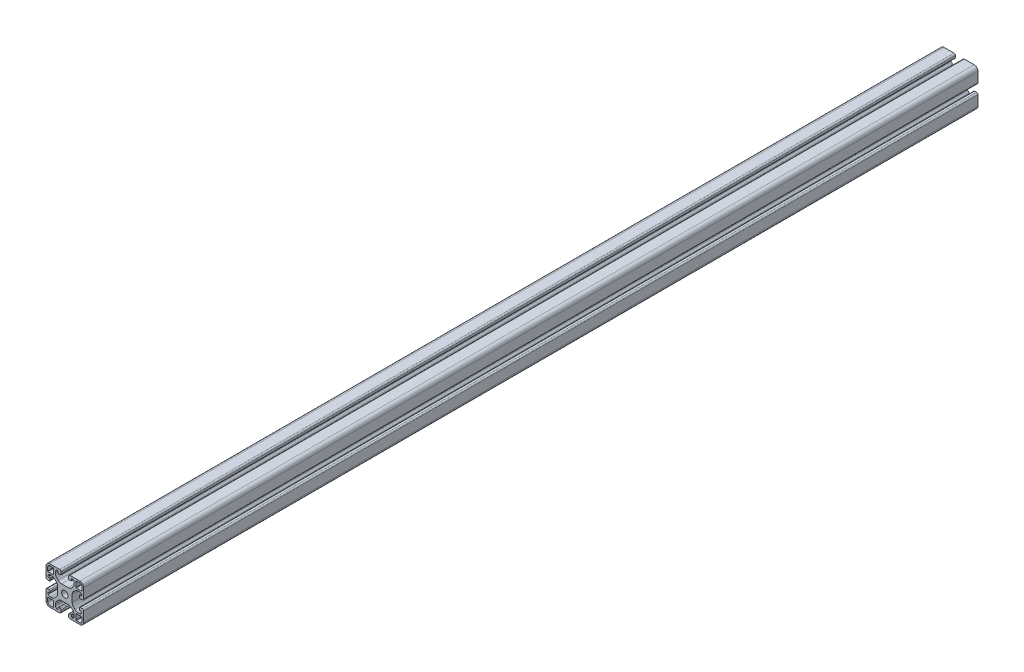
from build123d import *

# Parameters (mm, degrees)
ESQUISSE1_R        = 3.4
BOSS_EXTRU_1_DEPTH = 950


with BuildPart() as part:
    # Esquisse1 → Boss.-Extru.1 (new body)
    with BuildSketch(Plane(origin=(0, 0, -30), x_dir=(-1, 0, 0), z_dir=(0, 0, -1))):
        with BuildLine():
            Line((-4.5, 15), (-4.5, 13.5))
            ThreePointArc((-4.5, 13.5), (-4.353553391, 13.146446609), (-4, 13))
            Line((-4, 13), (-2.5, 13))
            ThreePointArc((-2.5, 13), (-2.146446609, 12.853553391), (-2, 12.5))
            ThreePointArc((-2, 12.5), (-2.732233047, 10.732233047), (-4.5, 10))
            Line((-4.5, 10), (-5.807611845, 10))
            ThreePointArc((-5.807611845, 10), (-7.721029006, 10.380602337), (-9.343145751, 11.464466094))
            Line((-9.343145751, 11.464466094), (-10.785533906, 12.906854249))
            ThreePointArc((-10.785533906, 12.906854249), (-11.869397663, 14.528970994), (-12.25, 16.442388155))
            Line((-12.25, 16.442388155), (-12.25, 23.557611845))
            ThreePointArc((-12.25, 23.557611845), (-11.869397663, 25.471029006), (-10.785533906, 27.093145751))
            Line((-10.785533906, 27.093145751), (-9.343145751, 28.535533906))
            ThreePointArc((-9.343145751, 28.535533906), (-7.721029006, 29.619397663), (-5.807611845, 30))
            Line((-5.807611845, 30), (-4.5, 30))
            ThreePointArc((-4.5, 30), (-2.732233047, 29.267766953), (-2, 27.5))
            ThreePointArc((-2, 27.5), (-2.146446609, 27.146446609), (-2.5, 27))
            Line((-2.5, 27), (-4, 27))
            ThreePointArc((-4, 27), (-4.353553391, 26.853553391), (-4.5, 26.5))
            Line((-4.5, 26.5), (-4.5, 25))
            ThreePointArc((-4.5, 25), (-4.207106781, 24.292893219), (-3.5, 24))
            Line((-3.5, 24), (-1.5, 24))
            ThreePointArc((-1.5, 24), (-0.439339828, 24.439339828), (0, 25.5))
            Line((0, 25.5), (0, 36))
            ThreePointArc((0, 36), (-1.171572875, 38.828427125), (-4, 40))
            Line((-4, 40), (-14.5, 40))
            ThreePointArc((-14.5, 40), (-15.560660172, 39.560660172), (-16, 38.5))
            Line((-16, 38.5), (-16, 36.5))
            ThreePointArc((-16, 36.5), (-15.707106781, 35.792893219), (-15, 35.5))
            Line((-15, 35.5), (-13.5, 35.5))
            ThreePointArc((-13.5, 35.5), (-13.146446609, 35.646446609), (-13, 36))
            Line((-13, 36), (-13, 37.5))
            ThreePointArc((-13, 37.5), (-12.853553391, 37.853553391), (-12.5, 38))
            ThreePointArc((-12.5, 38), (-10.732233047, 37.267766953), (-10, 35.5))
            Line((-10, 35.5), (-10, 34.192388155))
            ThreePointArc((-10, 34.192388155), (-10.380602337, 32.278970994), (-11.464466094, 30.656854249))
            Line((-11.464466094, 30.656854249), (-12.906854249, 29.214466094))
            ThreePointArc((-12.906854249, 29.214466094), (-14.528970994, 28.130602337), (-16.442388155, 27.75))
            Line((-16.442388155, 27.75), (-23.557611845, 27.75))
            ThreePointArc((-23.557611845, 27.75), (-25.471029006, 28.130602337), (-27.093145751, 29.214466094))
            Line((-27.093145751, 29.214466094), (-28.535533906, 30.656854249))
            ThreePointArc((-28.535533906, 30.656854249), (-29.619397663, 32.278970994), (-30, 34.192388155))
            Line((-30, 34.192388155), (-30, 35.5))
            ThreePointArc((-30, 35.5), (-29.267766953, 37.267766953), (-27.5, 38))
            ThreePointArc((-27.5, 38), (-27.146446609, 37.853553391), (-27, 37.5))
            Line((-27, 37.5), (-27, 36))
            ThreePointArc((-27, 36), (-26.853553391, 35.646446609), (-26.5, 35.5))
            Line((-26.5, 35.5), (-25, 35.5))
            ThreePointArc((-25, 35.5), (-24.292893219, 35.792893219), (-24, 36.5))
            Line((-24, 36.5), (-24, 38.5))
            ThreePointArc((-24, 38.5), (-24.439339828, 39.560660172), (-25.5, 40))
            Line((-25.5, 40), (-36, 40))
            ThreePointArc((-36, 40), (-38.828427125, 38.828427125), (-40, 36))
            Line((-40, 36), (-40, 25.5))
            ThreePointArc((-40, 25.5), (-39.560660172, 24.439339828), (-38.5, 24))
            Line((-38.5, 24), (-36.5, 24))
            ThreePointArc((-36.5, 24), (-35.792893219, 24.292893219), (-35.5, 25))
            Line((-35.5, 25), (-35.5, 26.5))
            ThreePointArc((-35.5, 26.5), (-35.646446609, 26.853553391), (-36, 27))
            Line((-36, 27), (-37.5, 27))
            ThreePointArc((-37.5, 27), (-37.853553391, 27.146446609), (-38, 27.5))
            ThreePointArc((-38, 27.5), (-37.267766953, 29.267766953), (-35.5, 30))
            Line((-35.5, 30), (-34.192388155, 30))
            ThreePointArc((-34.192388155, 30), (-32.278970994, 29.619397663), (-30.656854249, 28.535533906))
            Line((-30.656854249, 28.535533906), (-29.214466094, 27.093145751))
            ThreePointArc((-29.214466094, 27.093145751), (-28.130602337, 25.471029006), (-27.75, 23.557611845))
            Line((-27.75, 23.557611845), (-27.75, 16.442388155))
            ThreePointArc((-27.75, 16.442388155), (-28.130602337, 14.528970994), (-29.214466094, 12.906854249))
            Line((-29.214466094, 12.906854249), (-30.656854249, 11.464466094))
            ThreePointArc((-30.656854249, 11.464466094), (-32.278970994, 10.380602337), (-34.192388155, 10))
            Line((-34.192388155, 10), (-35.5, 10))
            ThreePointArc((-35.5, 10), (-37.267766953, 10.732233047), (-38, 12.5))
            ThreePointArc((-38, 12.5), (-37.853553391, 12.853553391), (-37.5, 13))
            Line((-37.5, 13), (-36, 13))
            ThreePointArc((-36, 13), (-35.646446609, 13.146446609), (-35.5, 13.5))
            Line((-35.5, 13.5), (-35.5, 15))
            ThreePointArc((-35.5, 15), (-35.792893219, 15.707106781), (-36.5, 16))
            Line((-36.5, 16), (-38.5, 16))
            ThreePointArc((-38.5, 16), (-39.560660172, 15.560660172), (-40, 14.5))
            Line((-40, 14.5), (-40, 4))
            ThreePointArc((-40, 4), (-38.828427125, 1.171572875), (-36, 0))
            Line((-36, 0), (-25.5, 0))
            ThreePointArc((-25.5, 0), (-24.439339828, 0.439339828), (-24, 1.5))
            Line((-24, 1.5), (-24, 3.5))
            ThreePointArc((-24, 3.5), (-24.292893219, 4.207106781), (-25, 4.5))
            Line((-25, 4.5), (-26.5, 4.5))
            ThreePointArc((-26.5, 4.5), (-26.853553391, 4.353553391), (-27, 4))
            Line((-27, 4), (-27, 2.5))
            ThreePointArc((-27, 2.5), (-27.146446609, 2.146446609), (-27.5, 2))
            ThreePointArc((-27.5, 2), (-29.267766953, 2.732233047), (-30, 4.5))
            Line((-30, 4.5), (-30, 5.807611845))
            ThreePointArc((-30, 5.807611845), (-29.619397663, 7.721029006), (-28.535533906, 9.343145751))
            Line((-28.535533906, 9.343145751), (-27.093145751, 10.785533906))
            ThreePointArc((-27.093145751, 10.785533906), (-25.471029006, 11.869397663), (-23.557611845, 12.25))
            Line((-23.557611845, 12.25), (-16.442388155, 12.25))
            ThreePointArc((-16.442388155, 12.25), (-14.528970994, 11.869397663), (-12.906854249, 10.785533906))
            Line((-12.906854249, 10.785533906), (-11.464466094, 9.343145751))
            ThreePointArc((-11.464466094, 9.343145751), (-10.380602337, 7.721029006), (-10, 5.807611845))
            Line((-10, 5.807611845), (-10, 4.5))
            ThreePointArc((-10, 4.5), (-10.732233047, 2.732233047), (-12.5, 2))
            ThreePointArc((-12.5, 2), (-12.853553391, 2.146446609), (-13, 2.5))
            Line((-13, 2.5), (-13, 4))
            ThreePointArc((-13, 4), (-13.146446609, 4.353553391), (-13.5, 4.5))
            Line((-13.5, 4.5), (-15, 4.5))
            ThreePointArc((-15, 4.5), (-15.707106781, 4.207106781), (-16, 3.5))
            Line((-16, 3.5), (-16, 1.5))
            ThreePointArc((-16, 1.5), (-15.560660172, 0.439339828), (-14.5, 0))
            Line((-14.5, 0), (-4, 0))
            ThreePointArc((-4, 0), (-1.171572875, 1.171572875), (0, 4))
            Line((0, 4), (0, 14.5))
            ThreePointArc((0, 14.5), (-0.439339828, 15.560660172), (-1.5, 16))
            Line((-1.5, 16), (-3.5, 16))
            ThreePointArc((-3.5, 16), (-4.207106781, 15.707106781), (-4.5, 15))
        make_face()
        with Locations((-20, 20)):
            Circle(ESQUISSE1_R, mode=Mode.SUBTRACT)
        with BuildLine():
            Line((-4, 1.8), (-7.7, 1.8))
            ThreePointArc((-7.7, 1.8), (-8.053553391, 1.946446609), (-8.2, 2.3))
            Line((-8.2, 2.3), (-8.2, 7.7))
            ThreePointArc((-8.2, 7.7), (-8.053553391, 8.053553391), (-7.7, 8.2))
            Line((-7.7, 8.2), (-2.3, 8.2))
            ThreePointArc((-2.3, 8.2), (-1.946446609, 8.053553391), (-1.8, 7.7))
            Line((-1.8, 7.7), (-1.8, 4))
            ThreePointArc((-1.8, 4), (-2.444365081, 2.444365081), (-4, 1.8))
        make_face(mode=Mode.SUBTRACT)
        with BuildLine():
            Line((-38.2, 4), (-38.2, 7.7))
            ThreePointArc((-38.2, 7.7), (-38.053553391, 8.053553391), (-37.7, 8.2))
            Line((-37.7, 8.2), (-32.3, 8.2))
            ThreePointArc((-32.3, 8.2), (-31.946446609, 8.053553391), (-31.8, 7.7))
            Line((-31.8, 7.7), (-31.8, 2.3))
            ThreePointArc((-31.8, 2.3), (-31.946446609, 1.946446609), (-32.3, 1.8))
            Line((-32.3, 1.8), (-36, 1.8))
            ThreePointArc((-36, 1.8), (-37.555634919, 2.444365081), (-38.2, 4))
        make_face(mode=Mode.SUBTRACT)
        with BuildLine():
            Line((-36, 38.2), (-32.3, 38.2))
            ThreePointArc((-32.3, 38.2), (-31.946446609, 38.053553391), (-31.8, 37.7))
            Line((-31.8, 37.7), (-31.8, 32.3))
            ThreePointArc((-31.8, 32.3), (-31.946446609, 31.946446609), (-32.3, 31.8))
            Line((-32.3, 31.8), (-37.7, 31.8))
            ThreePointArc((-37.7, 31.8), (-38.053553391, 31.946446609), (-38.2, 32.3))
            Line((-38.2, 32.3), (-38.2, 36))
            ThreePointArc((-38.2, 36), (-37.555634919, 37.555634919), (-36, 38.2))
        make_face(mode=Mode.SUBTRACT)
        with BuildLine():
            Line((-1.8, 36), (-1.8, 32.3))
            ThreePointArc((-1.8, 32.3), (-1.946446609, 31.946446609), (-2.3, 31.8))
            Line((-2.3, 31.8), (-7.7, 31.8))
            ThreePointArc((-7.7, 31.8), (-8.053553391, 31.946446609), (-8.2, 32.3))
            Line((-8.2, 32.3), (-8.2, 37.7))
            ThreePointArc((-8.2, 37.7), (-8.053553391, 38.053553391), (-7.7, 38.2))
            Line((-7.7, 38.2), (-4, 38.2))
            ThreePointArc((-4, 38.2), (-2.444365081, 37.555634919), (-1.8, 36))
        make_face(mode=Mode.SUBTRACT)
    extrude(amount=-BOSS_EXTRU_1_DEPTH)


solid = part.part
